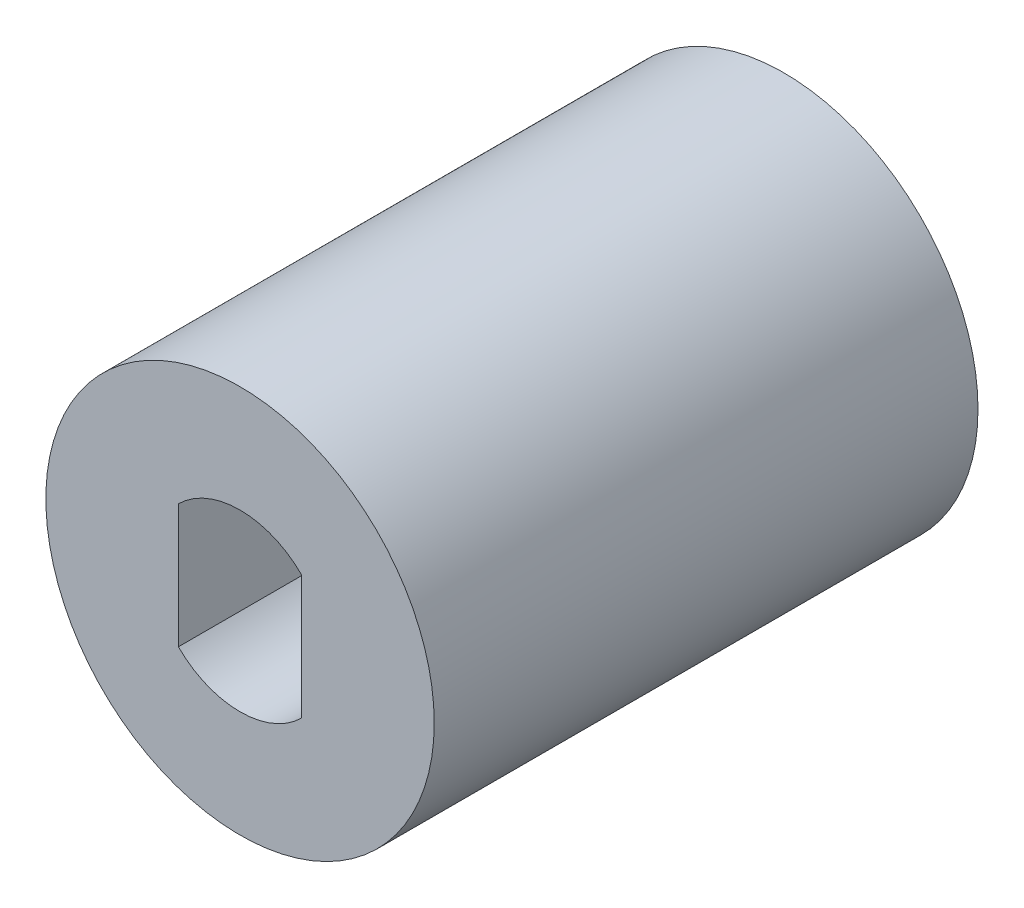
from build123d import *

# Parameters (mm, degrees)
SKETCH_1_R          = 10
EXTRUDE_1_DEPTH     = 14
SKETCH_3_R          = 6
CUT_EXTRUDE_1_DEPTH = 5
SKETCH_2_R          = 4.5
EXTRUDE_2_DEPTH     = 9


with BuildPart() as part:
    # 草图1 → 凸台-拉伸1 (new, symmetric)
    with BuildSketch(Plane.XY):
        Circle(SKETCH_1_R)
        with BuildLine():
            Line((4, 3), (4, -3))
            ThreePointArc((4, -3), (-5, 0), (4, 3))
        make_face(mode=Mode.SUBTRACT)
    extrude(amount=EXTRUDE_1_DEPTH, both=True)

    # 草图3 → 切除-拉伸1 (cut, symmetric)
    with BuildSketch(Plane.XY):
        Circle(SKETCH_3_R)
    extrude(amount=CUT_EXTRUDE_1_DEPTH, both=True, mode=Mode.SUBTRACT)

    # 草图2 → 凸台-拉伸2 (add)
    # profile 1 of 4: a face of its own
    with BuildSketch(Plane.XY.offset(14)):
        with BuildLine():
            Line((4, 3), (4, -3))
            ThreePointArc((4, -3), (-5, 0), (4, 3))
        make_face()
        Circle(SKETCH_2_R, mode=Mode.SUBTRACT)
    # profile 2 of 4: a face of its own
    with BuildSketch(Plane.XY.offset(14)):
        with BuildLine():
            ThreePointArc((-3.175, 3.188945751), (-4.5, 0), (-3.175, -3.188945751))
            Line((-3.175, -3.188945751), (-3.175, 3.188945751))
        make_face()
    # profile 3 of 4: a face of its own
    with BuildSketch(Plane.XY.offset(14)):
        with BuildLine():
            Line((4, 2.061552813), (4, -2.061552813))
            ThreePointArc((4, -2.061552813), (4.373213921, -1.060660172), (4.5, 0))
            ThreePointArc((4.5, 0), (4.373213921, 1.060660172), (4, 2.061552813))
        make_face()
    # profile 4 of 4: a face of its own
    with BuildSketch(Plane.XY.offset(14)):
        with BuildLine():
            ThreePointArc((3.175, -3.188945751), (3.631516207, -2.657459321), (4, -2.061552813))
            Line((4, -2.061552813), (4, 2.061552813))
            ThreePointArc((4, 2.061552813), (3.631516207, 2.657459321), (3.175, 3.188945751))
            Line((3.175, 3.188945751), (3.175, -3.188945751))
        make_face()
    extrude(amount=-EXTRUDE_2_DEPTH)


solid = part.part
